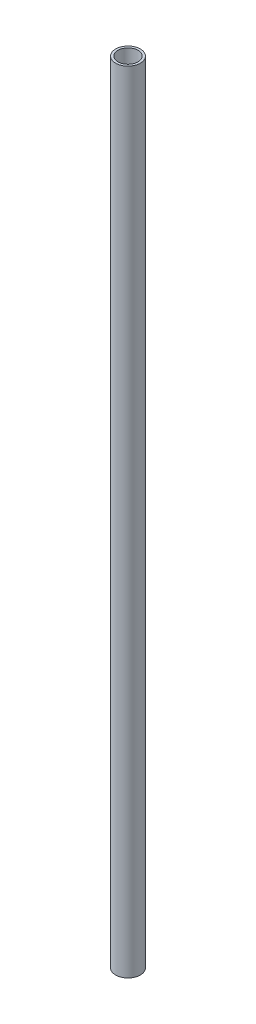
from build123d import *

# Parameters (mm, degrees)
SKETCH1_R           = 7.9375
SKETCH1_R_2         = 6.4643
BOSS_EXTRUDE1_DEPTH = 508


with BuildPart() as part:
    # Sketch1 → Boss-Extrude1 (new body)
    with BuildSketch(Plane(origin=(0, 0, 0), x_dir=(1, 0, 0), z_dir=(0, 1, 0))):
        Circle(SKETCH1_R)
        Circle(SKETCH1_R_2, mode=Mode.SUBTRACT)
    extrude(amount=BOSS_EXTRUDE1_DEPTH)


solid = part.part
